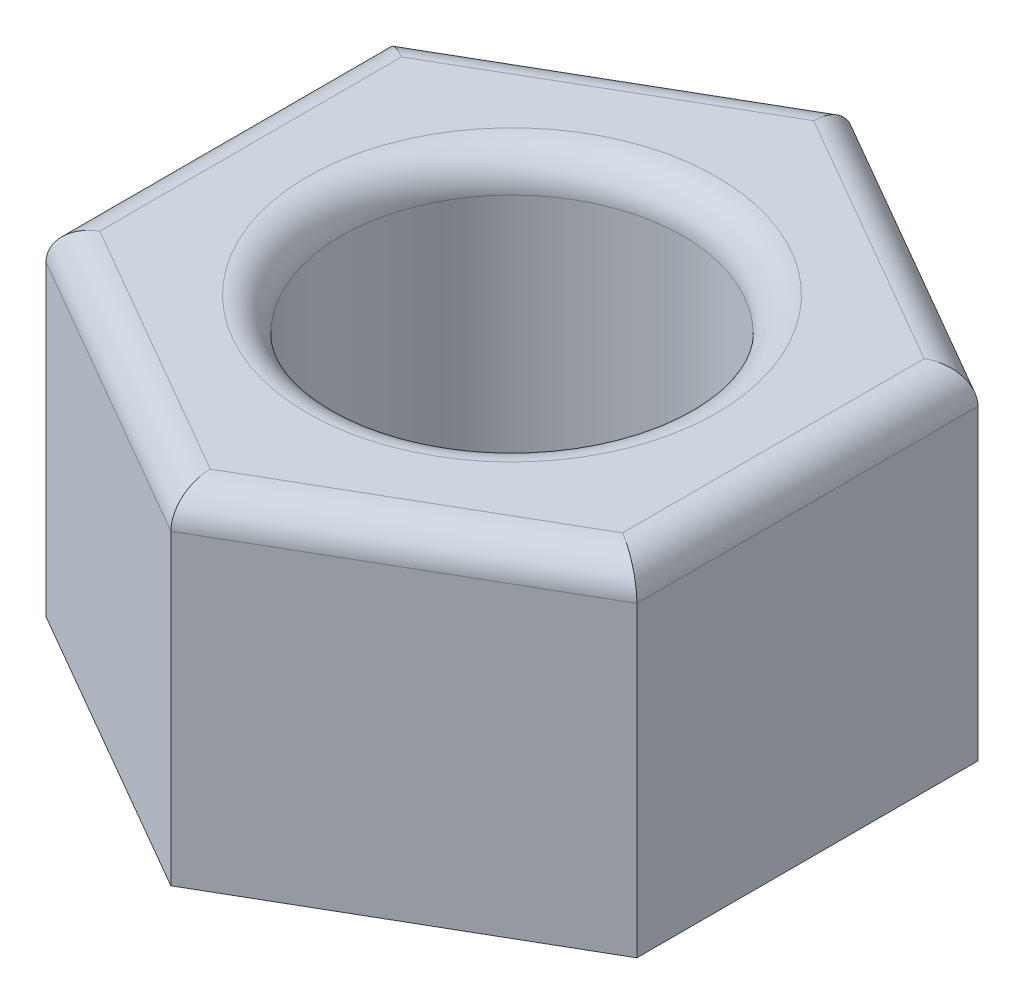
from build123d import *

# Parameters (mm, degrees)
SKETCH1_R           = 2.5
BOSS_EXTRUDE1_DEPTH = 5
FILLET1_R           = 0.5


with BuildPart() as part:
    # Sketch1 → Boss-Extrude1 (new body)
    with BuildSketch(Plane(origin=(0, 0, 0), x_dir=(1, 0, 0), z_dir=(0, 1, 0))):
        Polygon((0, 5), (-4.330127019, 2.5), (-4.330127019, -2.5), (0, -5), (4.330127019, -2.5), (4.330127019, 2.5), align=None)
        with Locations(Location((0, 0, 0), (0, 0, 270))):
            Circle(SKETCH1_R, mode=Mode.SUBTRACT)
    extrude(amount=BOSS_EXTRUDE1_DEPTH)

    # Fillet1
    fillet1_edges = [part.edges().sort_by_distance(p)[0] for p in [
        (-4.330127019, 5, 0),
        (-2.165063509, 5, 3.75),
        (2.165063509, 5, 3.75),
        (0, 5, -2.5),
        (4.330127019, 5, 0),
        (2.165063509, 5, -3.75),
        (-2.165063509, 5, -3.75),
    ]]
    fillet(fillet1_edges, radius=FILLET1_R)


solid = part.part
